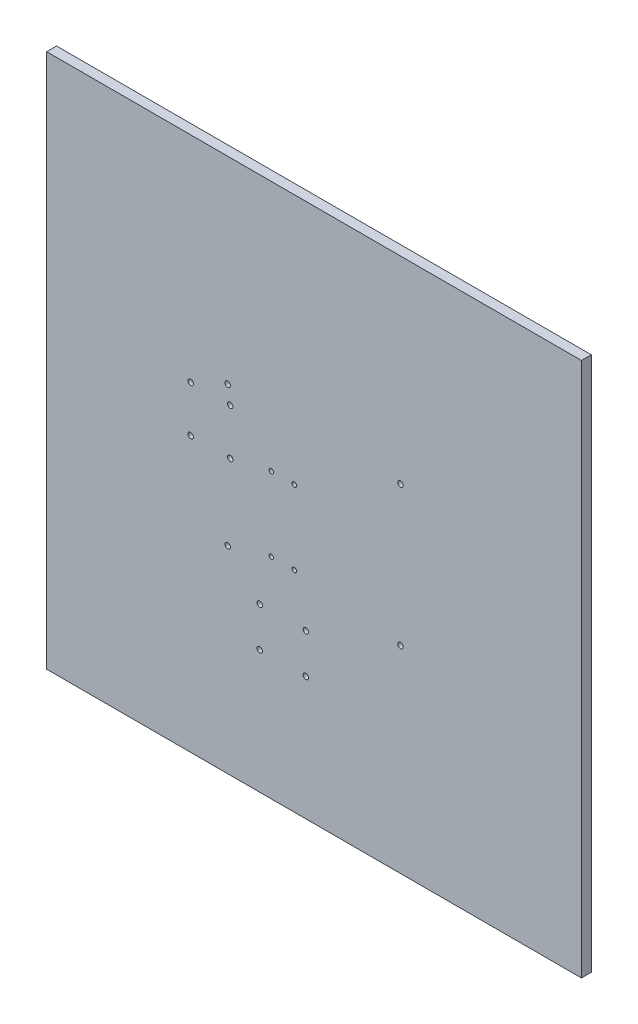
from build123d import *

# Parameters (mm, degrees)
SKETCH1_W                                = 650
SKETCH1_H                                = 650
BENCH_PLATE_DEPTH                        = 12
SKETCH2_R                                = 3.3
BENCH_M6_ANCHOR_HOLES_12X_D6P6_DEPTH     = 12
SKETCH3_R                                = 2.75
BENCH_M5_SUPPORTPOST_HOLES_4X_D5P5_DEPTH = 12


with BuildPart() as part:
    # Sketch1 → Bench_Plate (new body)
    with BuildSketch(Plane.XY):
        Rectangle(SKETCH1_W, SKETCH1_H)
    extrude(amount=BENCH_PLATE_DEPTH)

    # Sketch2 → Bench_M6_Anchor_Holes_12x_D6p6 (cut)
    with BuildSketch(Plane.XY.offset(12)):
        with Locations((-105, -85)):
            Circle(SKETCH2_R)
        with Locations((-105, 85)):
            Circle(SKETCH2_R)
        with Locations((105, -85)):
            Circle(SKETCH2_R)
        with Locations((105, 85)):
            Circle(SKETCH2_R)
        with Locations((-149.942838923, 8.5)):
            Circle(SKETCH2_R)
        with Locations((-101.942838923, 8.5)):
            Circle(SKETCH2_R)
        with Locations((-149.942838923, 64.5)):
            Circle(SKETCH2_R)
        with Locations((-101.942838923, 64.5)):
            Circle(SKETCH2_R)
        with Locations((-10, -174.995245402)):
            Circle(SKETCH2_R)
        with Locations((-10, -126.995245402)):
            Circle(SKETCH2_R)
        with Locations((-66, -174.995245402)):
            Circle(SKETCH2_R)
        with Locations((-66, -126.995245402)):
            Circle(SKETCH2_R)
    extrude(amount=-BENCH_M6_ANCHOR_HOLES_12X_D6P6_DEPTH, mode=Mode.SUBTRACT)

    # Sketch3 → Bench_M5_SupportPost_Holes_4x_D5p5 (cut)
    with BuildSketch(Plane.XY.offset(12)):
        with Locations((-52, -70)):
            Circle(SKETCH3_R)
        with Locations((-52, 20)):
            Circle(SKETCH3_R)
        with Locations((-24, -70)):
            Circle(SKETCH3_R)
        with Locations((-24, 20)):
            Circle(SKETCH3_R)
    extrude(amount=-BENCH_M5_SUPPORTPOST_HOLES_4X_D5P5_DEPTH, mode=Mode.SUBTRACT)


solid = part.part
